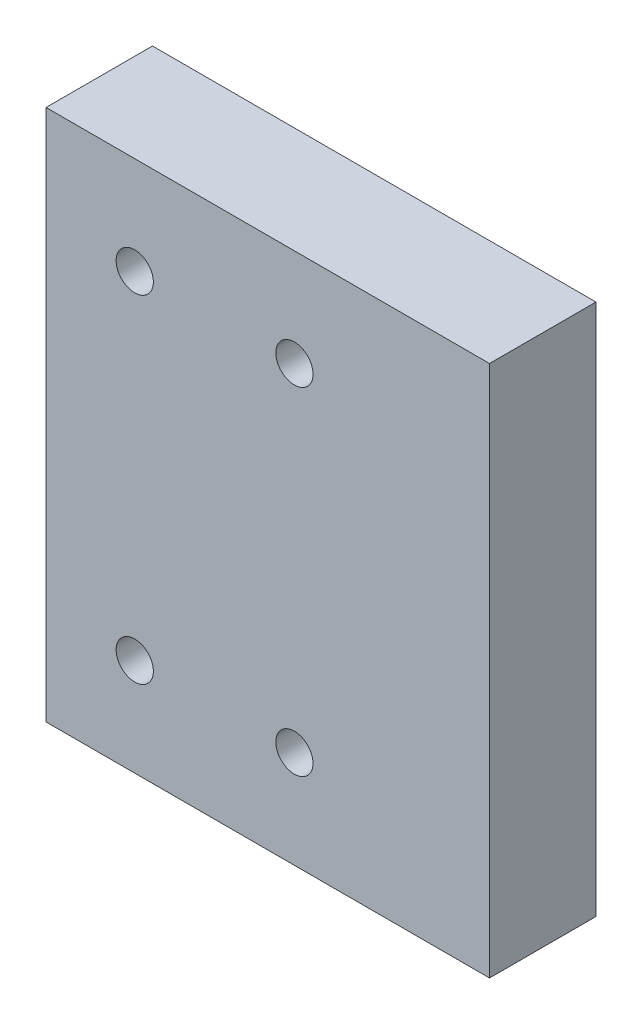
from build123d import *

# Parameters (mm, degrees)
SZKIC1_W                    = 50
SZKIC1_H                    = 60
DODANIE_WYCI_GNI_CIE1_DEPTH = 12
OTW_R_GWINTOWANY_M5X0_81_D  = 4.2


with BuildPart() as part:
    # Szkic1 → Dodanie-wyciągnięcie1 (new body)
    with BuildSketch(Plane.XY):
        with Locations((-78, 300)):
            Rectangle(SZKIC1_W, SZKIC1_H)
    extrude(amount=DODANIE_WYCI_GNI_CIE1_DEPTH)

    # Otwór gwintowany M5x0.81 (through all)
    with Locations(Plane.XY.offset(12)):
        with Locations((-93, 319), (-75, 319), (-75, 281), (-93, 281)):
            Hole(OTW_R_GWINTOWANY_M5X0_81_D / 2)


solid = part.part
